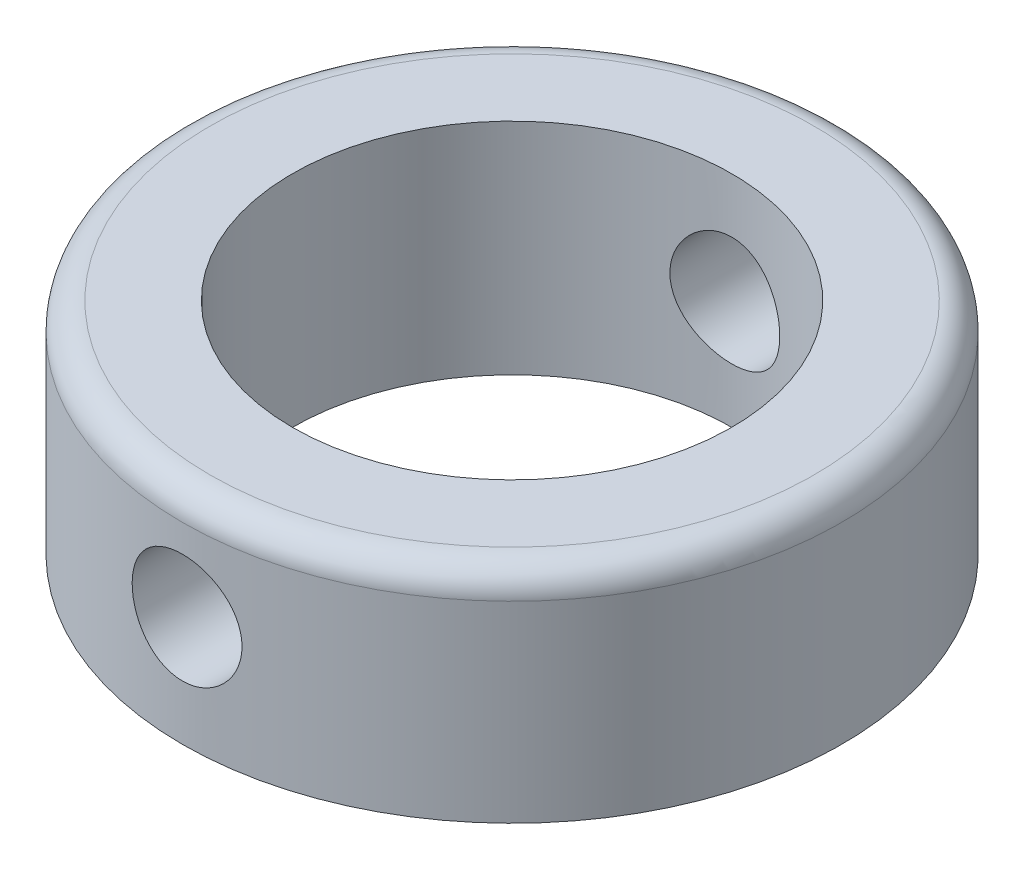
from build123d import *

# Parameters (mm, degrees)
SKETCH1_R           = 12
SKETCH1_R_2         = 8
BOSS_EXTRUDE1_DEPTH = 4
FILLET1_R           = 1
SKETCH2_R           = 2
CUT_EXTRUDE1_DEPTH  = 19


with BuildPart() as part:
    # Sketch1 → Boss-Extrude1 (new, symmetric)
    with BuildSketch(Plane(origin=(0, 0, 0), x_dir=(1, 0, 0), z_dir=(0, 1, 0))):
        with Locations(Location((0, 0, 0), (0, 0, 270))):
            Circle(SKETCH1_R)
        with Locations(Location((0, 0, 0), (0, 0, 270))):
            Circle(SKETCH1_R_2, mode=Mode.SUBTRACT)
    extrude(amount=BOSS_EXTRUDE1_DEPTH, both=True)

    # Fillet1
    fillet1_edges = [part.edges().sort_by_distance(p)[0] for p in [
        (0, 4, -12),
    ]]
    fillet(fillet1_edges, radius=FILLET1_R)

    # Sketch2 → Cut-Extrude1 (cut, symmetric)
    with BuildSketch(Plane.XY):
        Circle(SKETCH2_R)
    extrude(amount=CUT_EXTRUDE1_DEPTH, both=True, mode=Mode.SUBTRACT)


solid = part.part
